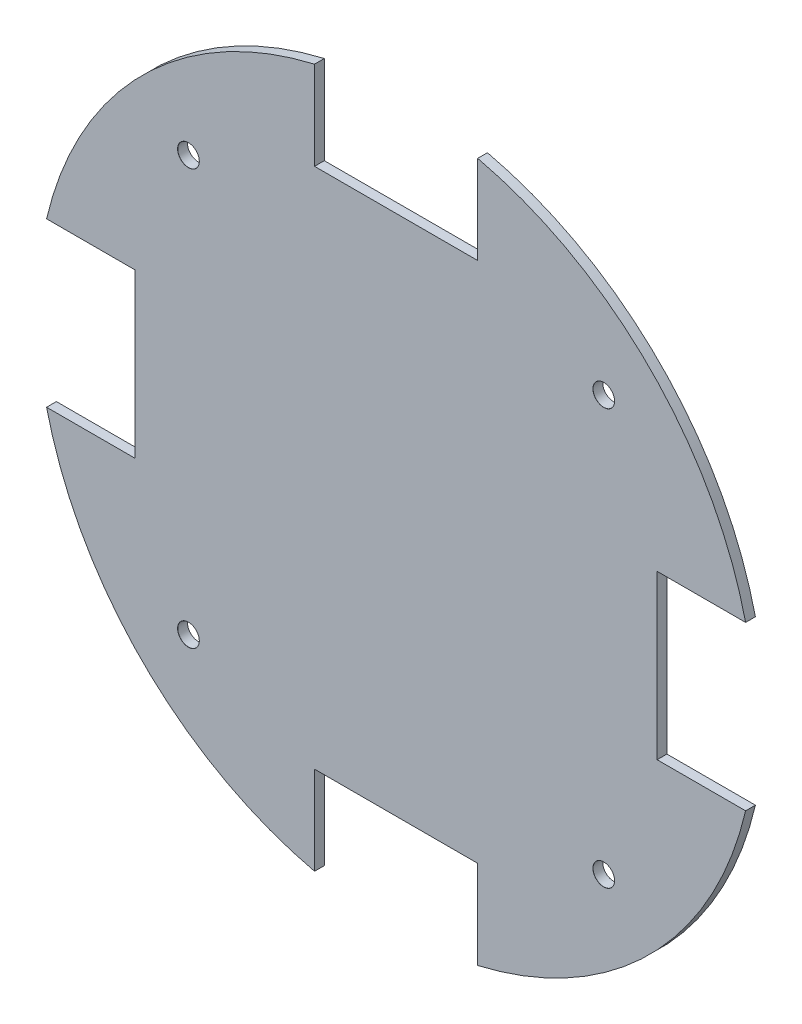
from build123d import *

# Parameters (mm, degrees)
ESQUISSE1_R               = 110
BOSS_EXTRU_1_DEPTH        = 3
D_GAGEMENT_M61_AT_2_COUNT = 2
D_GAGEMENT_M61_AT_2_PITCH = 127.279220614
D_GAGEMENT_M61_AT_3_COUNT = 2
D_GAGEMENT_M61_AT_3_PITCH = 127.279220614
D_GAGEMENT_M61_AT_4_COUNT = 2
D_GAGEMENT_M61_AT_4_PITCH = 180
ESQUISSE2_W               = 30
ESQUISSE2_H               = 50
ESQUISSE2_W_2             = 50
ESQUISSE2_H_2             = 30
ENL_V_MAT_EXTRU_1_DEPTH   = 10


with BuildPart() as part:
    # Esquisse1 → Boss.-Extru.1 (new body)
    with BuildSketch(Plane.XY):
        Circle(ESQUISSE1_R)
    extrude(amount=BOSS_EXTRU_1_DEPTH)

    # Esquisse4 → Dégagement M61 (revolve, cut)
    with BuildSketch(Plane(origin=(-63.639610307, 63.639610307, 3), x_dir=(0, -1, 0), z_dir=(1, 0, 0))):
        Polygon((0, 0), (0, 3), (3.3, 3), (3.3, 0.025), (3.325, 0), align=None)
    d_gagement_m61 = revolve(axis=Axis((-63.639610307, 63.639610307, 9.35), (0, 0, -1)), mode=Mode.SUBTRACT)

    # Dégagement M61 at 2: Dégagement M61 ×2
    with Locations(*[(i * D_GAGEMENT_M61_AT_2_PITCH, 0, 0) for i in range(1, D_GAGEMENT_M61_AT_2_COUNT)]):
        add(d_gagement_m61, mode=Mode.SUBTRACT)

    # Dégagement M61 at 3: Dégagement M61 ×2
    with Locations(*[(0, -i * D_GAGEMENT_M61_AT_3_PITCH, 0) for i in range(1, D_GAGEMENT_M61_AT_3_COUNT)]):
        add(d_gagement_m61, mode=Mode.SUBTRACT)

    # Dégagement M61 at 4: Dégagement M61 ×2
    with Locations(*[Vector(0.7071067811865517, -0.7071067811865435, 0) * (i * D_GAGEMENT_M61_AT_4_PITCH) for i in range(1, D_GAGEMENT_M61_AT_4_COUNT)]):
        add(d_gagement_m61, mode=Mode.SUBTRACT)

    # Esquisse2 → Enlèv. mat.-Extru.1 (cut)
    with BuildSketch(Plane(origin=(0, 0, 0), x_dir=(-1, 0, 0), z_dir=(0, 0, -1))):
        with Locations((95, 0)):
            Rectangle(ESQUISSE2_W, ESQUISSE2_H)
        with Locations((-95, 0)):
            Rectangle(ESQUISSE2_W, ESQUISSE2_H)
        with Locations((0, -95)):
            Rectangle(ESQUISSE2_W_2, ESQUISSE2_H_2)
        with Locations((0, 95)):
            Rectangle(ESQUISSE2_W_2, ESQUISSE2_H_2)
    extrude(amount=-ENL_V_MAT_EXTRU_1_DEPTH, mode=Mode.SUBTRACT)


solid = part.part
